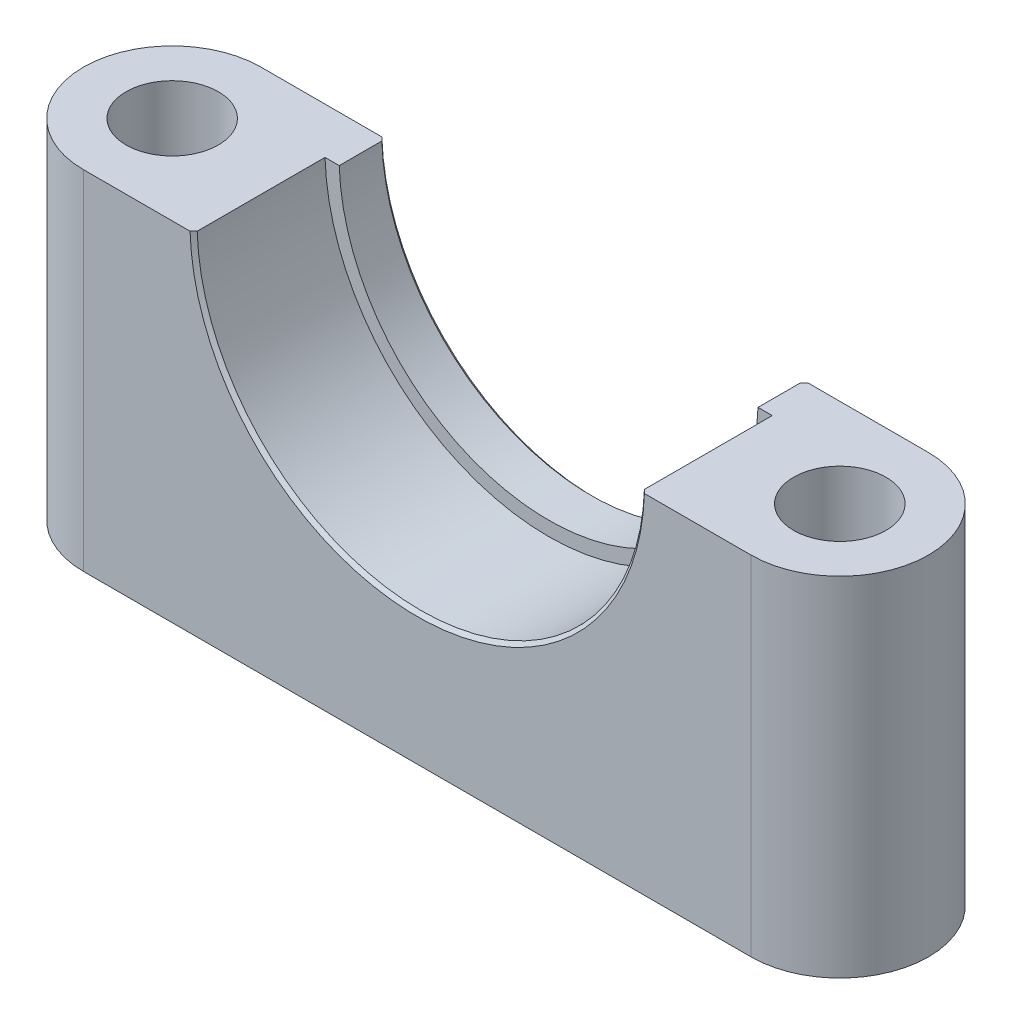
from build123d import *

# Parameters (mm, degrees)
SKETCH1_R           = 3.302
BOSS_EXTRUDE1_DEPTH = 24.892
SKETCH2_R           = 16.002
CUT_EXTRUDE1_DEPTH  = 9.398
SKETCH3_R           = 14.986
CUT_EXTRUDE2_DEPTH  = 17.78
CHAMFER1_SIZE       = 0.254


with BuildPart() as part:
    # Sketch1 → Boss-Extrude1 (new body)
    with BuildSketch(Plane(origin=(0, 0, 0), x_dir=(1, 0, 0), z_dir=(0, 1, 0))):
        with BuildLine():
            Line((-23.876, 6.35), (23.876, 6.35))
            ThreePointArc((23.876, 6.35), (30.226, 0), (23.876, -6.35))
            Line((23.876, -6.35), (-23.876, -6.35))
            ThreePointArc((-23.876, -6.35), (-30.226, 0), (-23.876, 6.35))
        make_face()
        with Locations(Location((23.876, 0, 0), (0, 0, 270))):
            Circle(SKETCH1_R, mode=Mode.SUBTRACT)
        with Locations(Location((-23.876, 0, 0), (0, 0, 270))):
            Circle(SKETCH1_R, mode=Mode.SUBTRACT)
    extrude(amount=BOSS_EXTRUDE1_DEPTH)

    # Sketch2 → Cut-Extrude1 (cut)
    with BuildSketch(Plane.XY.offset(6.35)):
        with Locations((0, 25.4)):
            Circle(SKETCH2_R)
    extrude(amount=-CUT_EXTRUDE1_DEPTH, mode=Mode.SUBTRACT)

    # Sketch3 → Cut-Extrude2 (cut)
    with BuildSketch(Plane.XY.offset(-3.048)):
        with Locations((0, 25.4)):
            Circle(SKETCH3_R)
    extrude(amount=-CUT_EXTRUDE2_DEPTH, mode=Mode.SUBTRACT)

    # Chamfer1
    chamfer1_edges = [part.edges().sort_by_distance(p)[0] for p in [
        (0, 9.398, 6.35),
        (0, 10.414, -6.35),
    ]]
    chamfer(chamfer1_edges, length=CHAMFER1_SIZE)


solid = part.part
